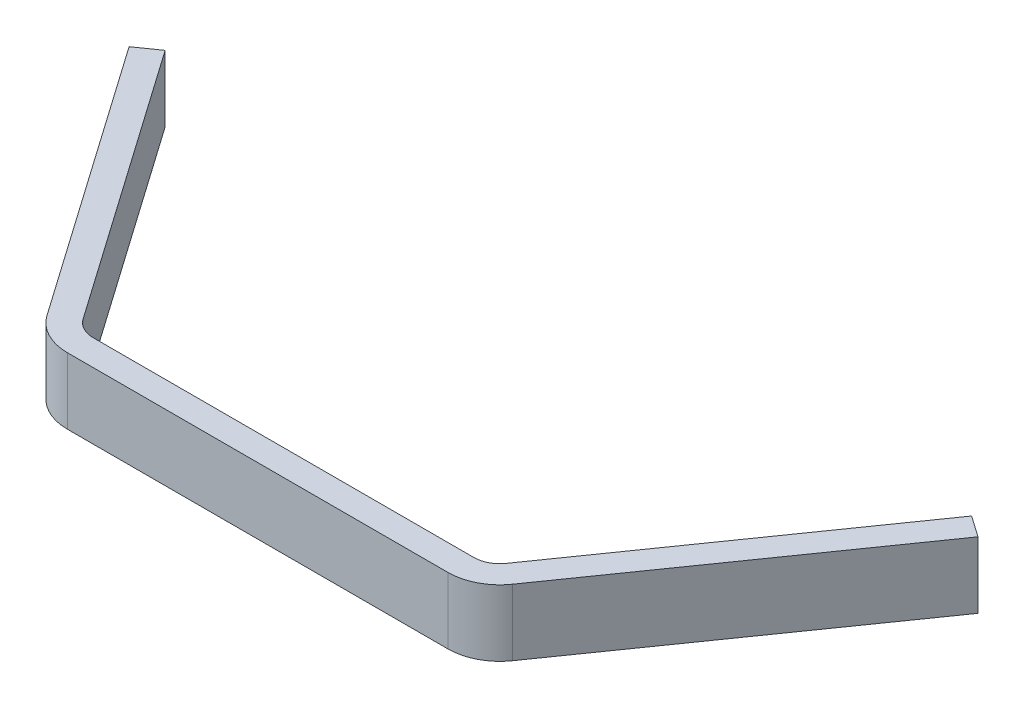
from build123d import *

# Parameters (mm, degrees)
BOSS_EXTRUDE1_DEPTH      = 5.588
BOSS_EXTRUDE1_DEPTH_BACK = 2.54


with BuildPart() as part:
    # Sketch1 → Boss-Extrude1 (new, two sides: drawn at the far end of the back side and taken through both)
    with BuildSketch(Plane(origin=(0, 0, 0), x_dir=(1, 0, 0), z_dir=(0, 1, 0)).offset(-BOSS_EXTRUDE1_DEPTH_BACK)):
        with BuildLine():
            Line((-49.445827732, 34.925), (-25.939086815, 1.353894815))
            ThreePointArc((-25.939086815, 1.353894815), (-24.804330922, 0.358740605), (-23.338279075, 0))
            Line((-23.338279075, 0), (23.338279075, 0))
            ThreePointArc((23.338279075, 0), (24.804330922, 0.358740605), (25.939086815, 1.353894815))
            Line((25.939086815, 1.353894815), (49.445827732, 34.925))
            Line((49.445827732, 34.925), (52.046635473, 33.103894815))
            Line((52.046635473, 33.103894815), (28.539894556, -0.467210371))
            ThreePointArc((28.539894556, -0.467210371), (26.270382769, -2.457518791), (23.338279075, -3.175))
            Line((23.338279075, -3.175), (-23.338279075, -3.175))
            ThreePointArc((-23.338279075, -3.175), (-26.270382769, -2.457518791), (-28.539894556, -0.467210371))
            Line((-28.539894556, -0.467210371), (-52.046635473, 33.103894815))
            Line((-52.046635473, 33.103894815), (-49.445827732, 34.925))
        make_face()
    extrude(amount=BOSS_EXTRUDE1_DEPTH + BOSS_EXTRUDE1_DEPTH_BACK)


solid = part.part
